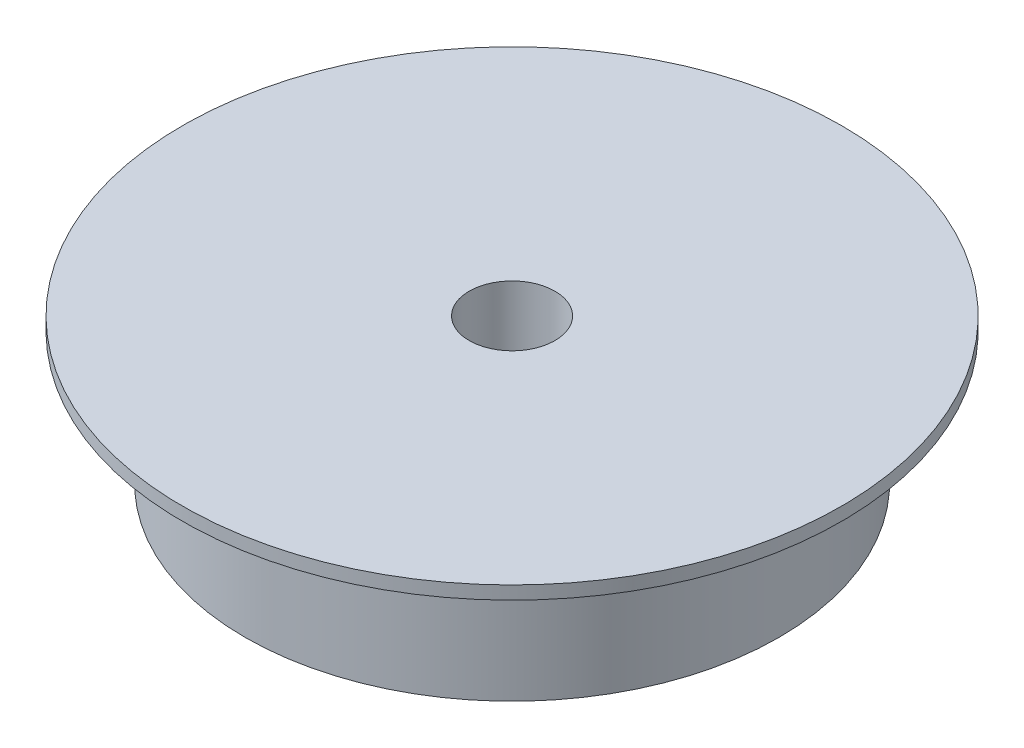
from build123d import *


with BuildPart() as part:
    # Sketch1 → Revolve1 (revolve)
    with BuildSketch(Plane.XY, mode=Mode.PRIVATE) as revolve1_sk:
        Polygon((16.25, 0), (16.25, 55), (125, 55), (125, 50), (101.25, 50), (101.25, 0), align=None)
    revolve(revolve1_sk.sketch.rotate(Axis((0, 0, 0), (0, 1, 0)), 90), axis=Axis((0, 0, 0), (0, 1, 0)))


solid = part.part
